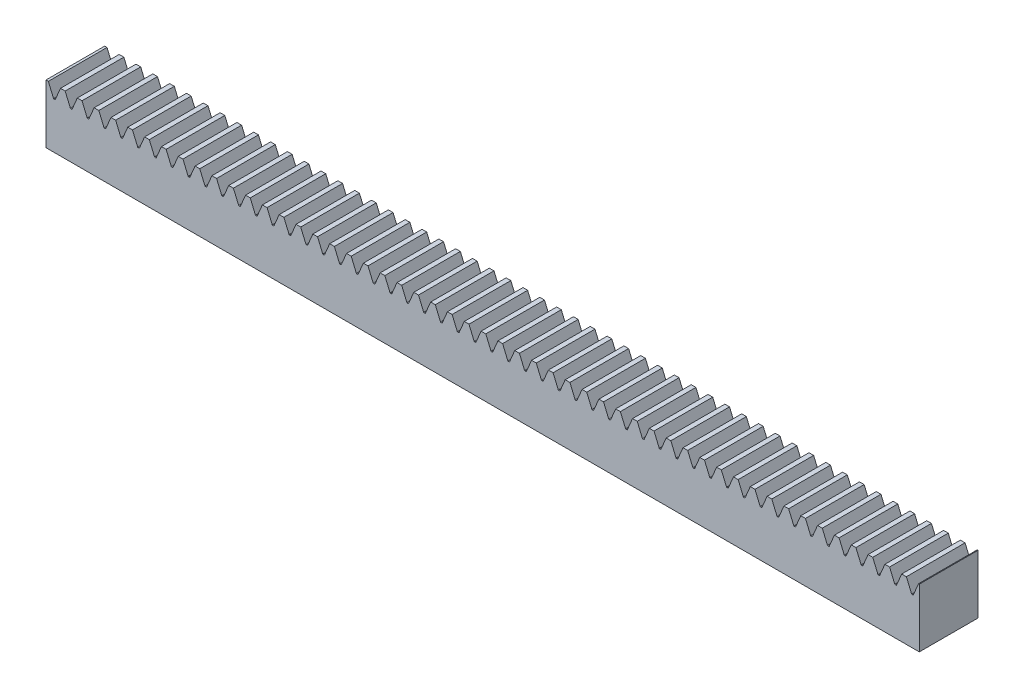
from build123d import *

# Parameters (mm, degrees)
SKETCH1_W              = 19.05
SKETCH1_H              = 19.05
BOSS_EXTRUDE1_DEPTH    = 283.464
CUT_EXTRUDE1_DEPTH     = 285.741363866
FILLET1_R              = 0.127
LPATTERN1_COUNT        = 52
LPATTERN1_PITCH        = 5.461
FILLET1_OF_LPATTERN1_R = 0.127


with BuildPart() as part:
    # Sketch1 → Boss-Extrude1 (new body)
    with BuildSketch(Plane(origin=(0, 0, 0), x_dir=(0, 0, -1), z_dir=(1, 0, 0))):
        with Locations((9.525, -9.525)):
            Rectangle(SKETCH1_W, SKETCH1_H)
    extrude(amount=BOSS_EXTRUDE1_DEPTH)

    # Sketch2 → Cut-Extrude1 (cut, through all)
    with BuildSketch(Plane.XY):
        Polygon((0.762, 0), (4.699, 0), (2.9845, -4.064), (2.4765, -4.064), align=None)
    cut_extrude1 = extrude(amount=-CUT_EXTRUDE1_DEPTH, mode=Mode.SUBTRACT)

    # Fillet1
    fillet1_edges = [part.edges().sort_by_distance(p)[0] for p in [
        (2.4765, -4.064, -9.525),
        (2.9845, -4.064, -9.525),
    ]]
    fillet(fillet1_edges, radius=FILLET1_R)

    # LPattern1: Cut-Extrude1 ×52
    with Locations(*[(i * LPATTERN1_PITCH, 0, 0) for i in range(1, LPATTERN1_COUNT)]):
        add(cut_extrude1, mode=Mode.SUBTRACT)

    # Fillet1 of LPattern1
    fillet1_of_lpattern1_edges = [part.edges().sort_by_distance(p)[0] for p in [
        (7.9375, -4.064, -9.525),
        (8.4455, -4.064, -9.525),
        (13.3985, -4.064, -9.525),
        (13.9065, -4.064, -9.525),
        (18.8595, -4.064, -9.525),
        (19.3675, -4.064, -9.525),
        (24.3205, -4.064, -9.525),
        (24.8285, -4.064, -9.525),
        (29.7815, -4.064, -9.525),
        (30.2895, -4.064, -9.525),
        (35.2425, -4.064, -9.525),
        (35.7505, -4.064, -9.525),
        (40.7035, -4.064, -9.525),
        (41.2115, -4.064, -9.525),
        (46.1645, -4.064, -9.525),
        (46.6725, -4.064, -9.525),
        (51.6255, -4.064, -9.525),
        (52.1335, -4.064, -9.525),
        (57.0865, -4.064, -9.525),
        (57.5945, -4.064, -9.525),
        (62.5475, -4.064, -9.525),
        (63.0555, -4.064, -9.525),
        (68.0085, -4.064, -9.525),
        (68.5165, -4.064, -9.525),
        (73.4695, -4.064, -9.525),
        (73.9775, -4.064, -9.525),
        (78.9305, -4.064, -9.525),
        (79.4385, -4.064, -9.525),
        (84.3915, -4.064, -9.525),
        (84.8995, -4.064, -9.525),
        (89.8525, -4.064, -9.525),
        (90.3605, -4.064, -9.525),
        (95.3135, -4.064, -9.525),
        (95.8215, -4.064, -9.525),
        (100.7745, -4.064, -9.525),
        (101.2825, -4.064, -9.525),
        (106.2355, -4.064, -9.525),
        (106.7435, -4.064, -9.525),
        (111.6965, -4.064, -9.525),
        (112.2045, -4.064, -9.525),
        (117.1575, -4.064, -9.525),
        (117.6655, -4.064, -9.525),
        (122.6185, -4.064, -9.525),
        (123.1265, -4.064, -9.525),
        (128.0795, -4.064, -9.525),
        (128.5875, -4.064, -9.525),
        (133.5405, -4.064, -9.525),
        (134.0485, -4.064, -9.525),
        (139.0015, -4.064, -9.525),
        (139.5095, -4.064, -9.525),
        (144.4625, -4.064, -9.525),
        (144.9705, -4.064, -9.525),
        (149.9235, -4.064, -9.525),
        (150.4315, -4.064, -9.525),
        (155.3845, -4.064, -9.525),
        (155.8925, -4.064, -9.525),
        (160.8455, -4.064, -9.525),
        (161.3535, -4.064, -9.525),
        (166.3065, -4.064, -9.525),
        (166.8145, -4.064, -9.525),
        (171.7675, -4.064, -9.525),
        (172.2755, -4.064, -9.525),
        (177.2285, -4.064, -9.525),
        (177.7365, -4.064, -9.525),
        (182.6895, -4.064, -9.525),
        (183.1975, -4.064, -9.525),
        (188.1505, -4.064, -9.525),
        (188.6585, -4.064, -9.525),
        (193.6115, -4.064, -9.525),
        (194.1195, -4.064, -9.525),
        (199.0725, -4.064, -9.525),
        (199.5805, -4.064, -9.525),
        (204.5335, -4.064, -9.525),
        (205.0415, -4.064, -9.525),
        (209.9945, -4.064, -9.525),
        (210.5025, -4.064, -9.525),
        (215.4555, -4.064, -9.525),
        (215.9635, -4.064, -9.525),
        (220.9165, -4.064, -9.525),
        (221.4245, -4.064, -9.525),
        (226.3775, -4.064, -9.525),
        (226.8855, -4.064, -9.525),
        (231.8385, -4.064, -9.525),
        (232.3465, -4.064, -9.525),
        (237.2995, -4.064, -9.525),
        (237.8075, -4.064, -9.525),
        (242.7605, -4.064, -9.525),
        (243.2685, -4.064, -9.525),
        (248.2215, -4.064, -9.525),
        (248.7295, -4.064, -9.525),
        (253.6825, -4.064, -9.525),
        (254.1905, -4.064, -9.525),
        (259.1435, -4.064, -9.525),
        (259.6515, -4.064, -9.525),
        (264.6045, -4.064, -9.525),
        (265.1125, -4.064, -9.525),
        (270.0655, -4.064, -9.525),
        (270.5735, -4.064, -9.525),
        (275.5265, -4.064, -9.525),
        (276.0345, -4.064, -9.525),
        (280.9875, -4.064, -9.525),
        (281.4955, -4.064, -9.525),
    ]]
    fillet(fillet1_of_lpattern1_edges, radius=FILLET1_OF_LPATTERN1_R)


solid = part.part
